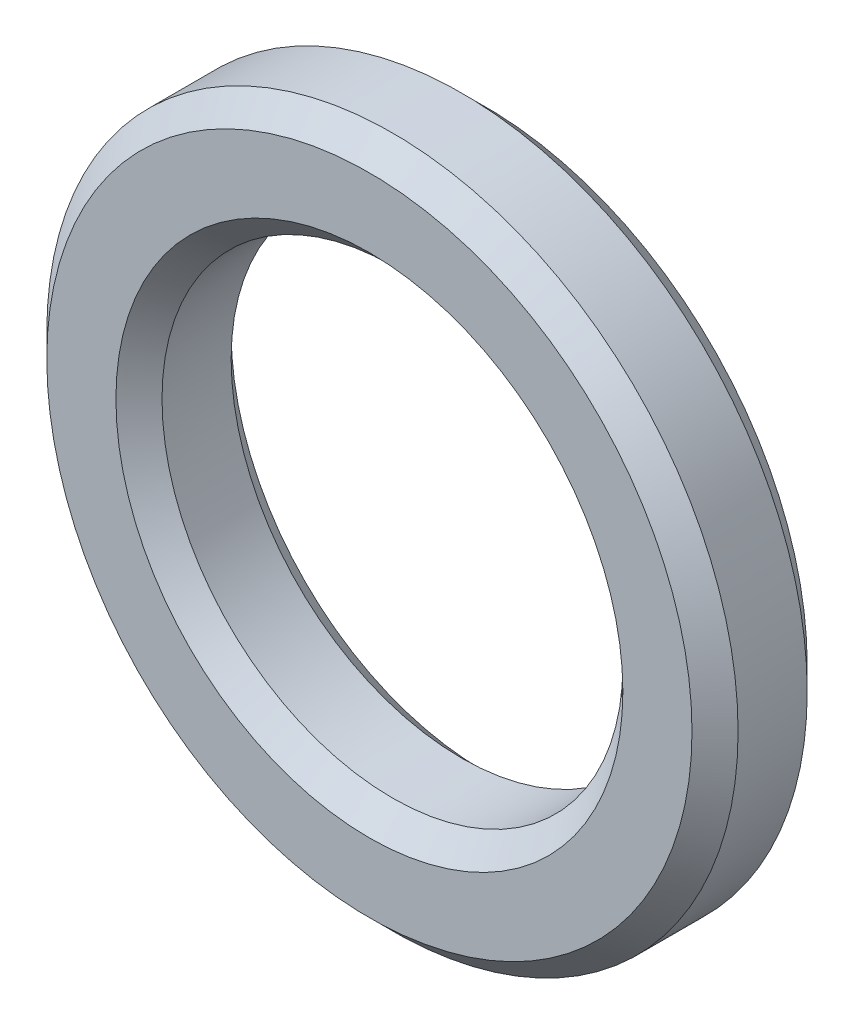
from build123d import *

# Parameters (mm, degrees)
SKETCH2_R           = 15
SKETCH2_R_2         = 10
EXTRUDE_THIN1_DEPTH = 5
CHAMFER1_SIZE       = 1


with BuildPart() as part:
    # Sketch2 → Extrude-Thin1 (new body)
    with BuildSketch(Plane.XY):
        Circle(SKETCH2_R)
        Circle(SKETCH2_R_2, mode=Mode.SUBTRACT)
    extrude(amount=EXTRUDE_THIN1_DEPTH)

    # Chamfer1
    chamfer1_edges = [part.edges().sort_by_distance(p)[0] for p in [
        (-15, 0, 0),
        (-10, 0, 0),
        (-15, 0, 5),
        (-10, 0, 5),
    ]]
    chamfer(chamfer1_edges, length=CHAMFER1_SIZE)


solid = part.part
